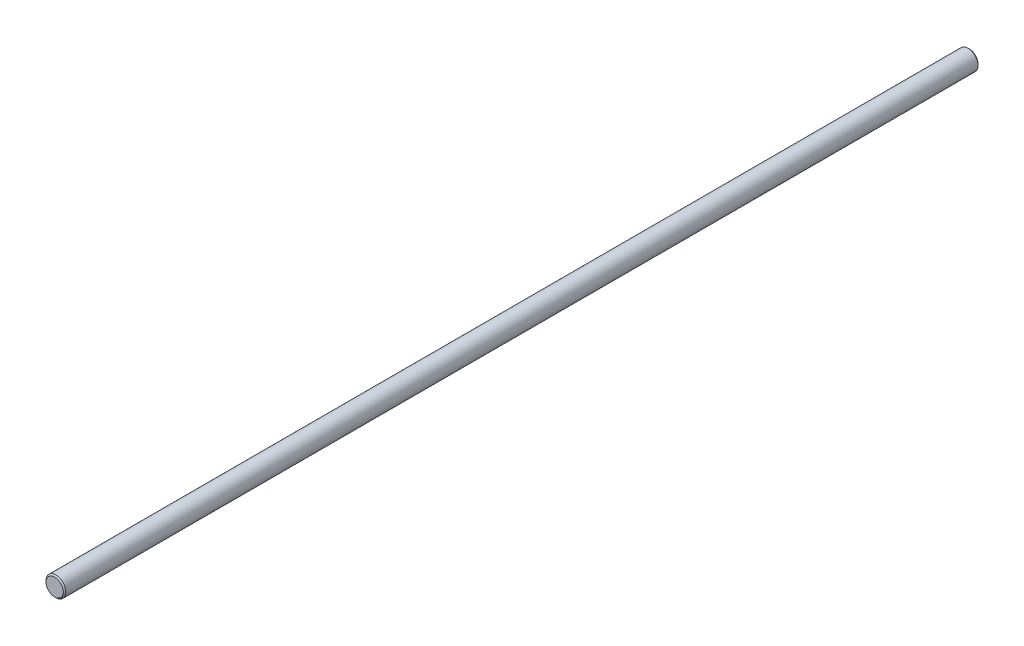
from build123d import *


with BuildPart() as part:
    # Sketch1 → Revolve1 (revolve)
    with BuildSketch(Plane.XZ, mode=Mode.PRIVATE) as revolve1_sk:
        Polygon((3.5, 370), (0, 370), (0, 0), (3.5, 0), (4, 0.5), (4, 369.5), align=None)
    revolve(revolve1_sk.sketch.rotate(Axis((0, 0, 370), (0, 0, -1)), 180), axis=Axis((0, 0, 370), (0, 0, -1)))


solid = part.part
